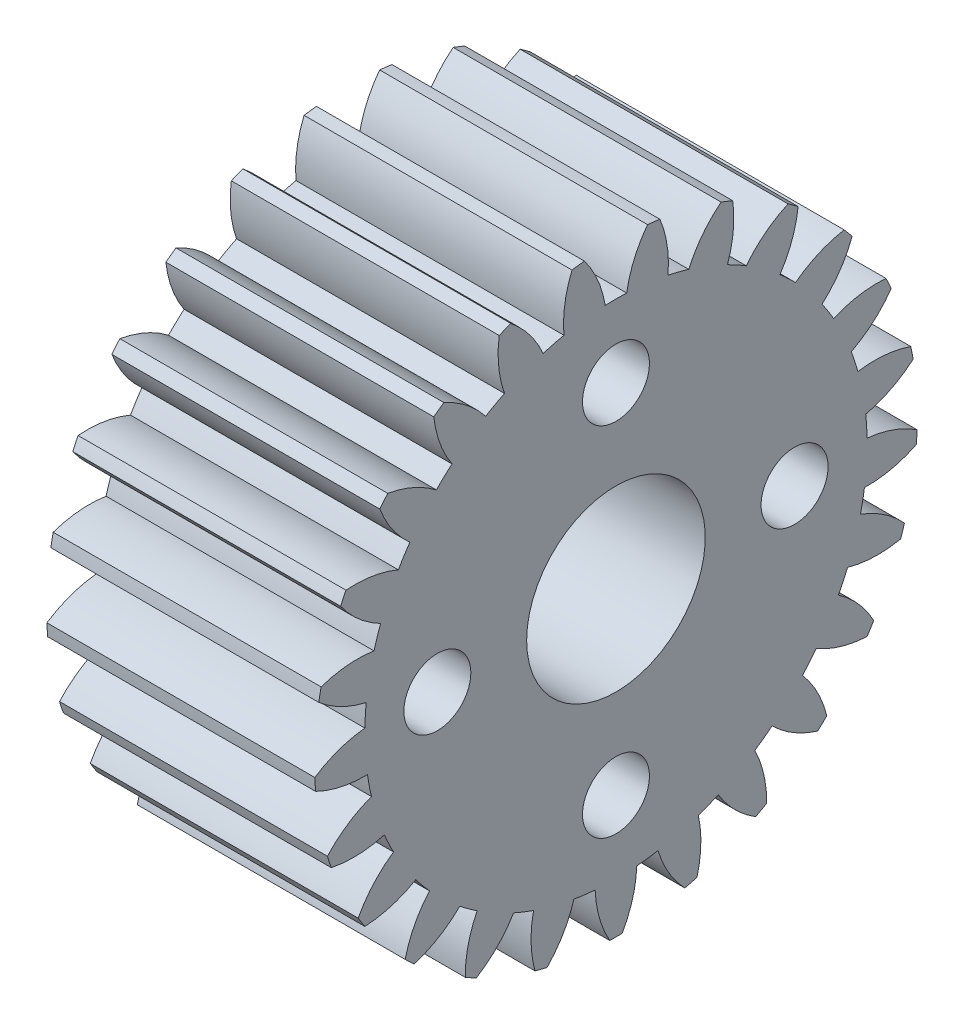
from build123d import *

# Parameters (mm, degrees)
BASPROSKE_W        = 12
BASPROSKE_H        = 13.5
TOOTHCUT_DEPTH     = 23.549944568
TEETHCUTS_COUNT    = 25
TEETHCUTS_ANGLE    = 345.6
BORSKE_R           = 4
BORE_DEPTH         = 50.0000508
SKETCH1_R          = 1.5
CUT_EXTRUDE1_DEPTH = 23.542777009


with BuildPart() as part:
    # BasProSke → Base-Revolve (revolve)
    with BuildSketch(Plane(origin=(0, 0, 0), x_dir=(1, 0, 0), z_dir=(0, 1, 0)), mode=Mode.PRIVATE) as base_revolve_sk:
        with Locations((6, 6.75)):
            Rectangle(BASPROSKE_W, BASPROSKE_H)
    revolve(base_revolve_sk.sketch.rotate(Axis((-10, 0, 0), (1, 0, 0)), 180), axis=Axis((-10, 0, 0), (1, 0, 0)))

    # TooCutSke → ToothCut (cut, through all)
    with BuildSketch(Plane(origin=(0, 0, 0), x_dir=(0, 0, -1), z_dir=(1, 0, 0))):
        with BuildLine():
            ThreePointArc((0.480087995, 11.238750665), (0, 11.249), (-0.480087995, 11.238750665))
            ThreePointArc((-0.480087995, 11.238750665), (-0.821124963, 12.40220054), (-1.432168974, 13.449361962))
            ThreePointArc((-1.432168974, 13.449361962), (0, 13.5254), (1.432168974, 13.449361962))
            ThreePointArc((1.432168974, 13.449361962), (0.821124963, 12.40220054), (0.480087995, 11.238750665))
        make_face()
    toothcut = extrude(amount=TOOTHCUT_DEPTH, mode=Mode.SUBTRACT)

    # TeethCuts: ToothCut ×25 about axis
    teethcuts_axis = Axis((-10, 0, 0), (1, 0, 0))
    for i in range(1, TEETHCUTS_COUNT):
        add(toothcut.rotate(teethcuts_axis, i * TEETHCUTS_ANGLE / (TEETHCUTS_COUNT - 1)), mode=Mode.SUBTRACT)

    # BorSke → Bore (cut, symmetric)
    with BuildSketch(Plane(origin=(0, 0, 0), x_dir=(0, 0, -1), z_dir=(1, 0, 0))):
        with Locations(Location((0, 0, 0), (0, 0, 180))):
            Circle(BORSKE_R)
    extrude(amount=BORE_DEPTH, both=True, mode=Mode.SUBTRACT)

    # Sketch1 → Cut-Extrude1 (cut, through all)
    with BuildSketch(Plane(origin=(12, 0, 0), x_dir=(0, 0, -1), z_dir=(1, 0, 0))):
        with Locations((0, 8)):
            Circle(SKETCH1_R)
        with Locations((8, 0)):
            Circle(SKETCH1_R)
        with Locations((0, -8)):
            Circle(SKETCH1_R)
        with Locations((-8, 0)):
            Circle(SKETCH1_R)
    extrude(amount=-CUT_EXTRUDE1_DEPTH, mode=Mode.SUBTRACT)


solid = part.part
